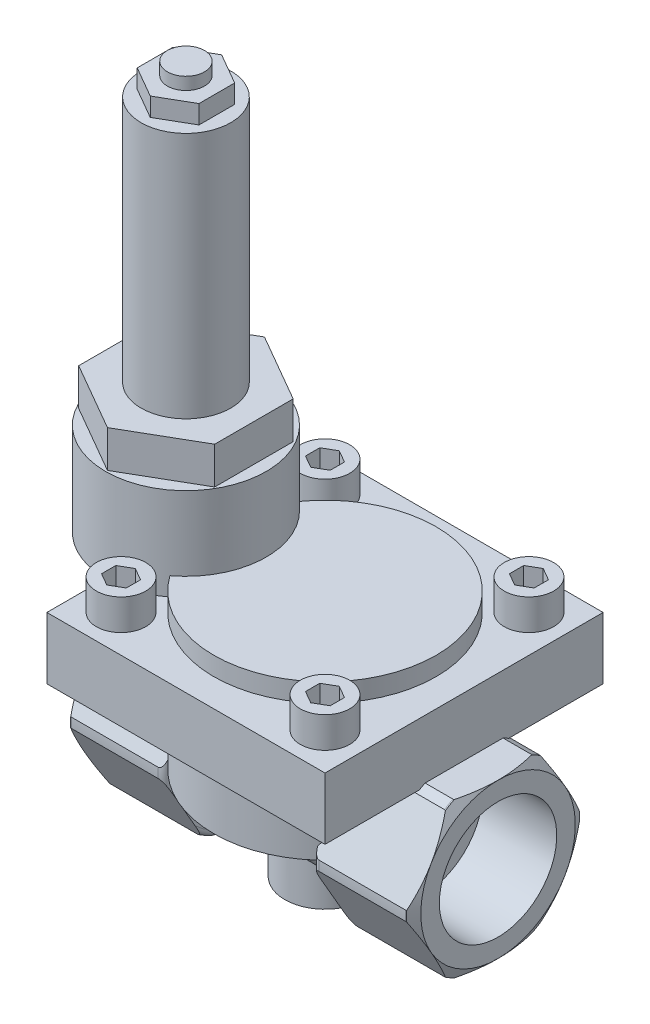
from build123d import *

# Parameters (mm, degrees)
SKIZZE2_OUTSIDE_W               = 43.718
SKIZZE2_OUTSIDE_H               = 43.718
SCHNITT_LINEAR_AUSTRAGEN1_DEPTH = 16
SKIZZE3_OUTSIDE_W               = 216.672
SKIZZE3_OUTSIDE_H               = 213.672
SKIZZE3_OUTSIDE_R               = 12.5
SCHNITT_LINEAR_AUSTRAGEN2_DEPTH = 48
SCHNITT_LINEAR_AUSTRAGEN2_DRAFT = -61
SPIEGELN2_COPY_1_SKETCH_W       = 216.672
SPIEGELN2_COPY_1_SKETCH_H       = 213.672
SPIEGELN2_COPY_1_SKETCH_R       = 12.5
SPIEGELN2_COPY_1_DEPTH          = 48
SPIEGELN2_COPY_1_DRAFT          = -61
SKIZZE4_R                       = 18
AUFSATZ_LINEAR_AUSTRAGEN1_DEPTH = 25
SKIZZE5_R                       = 6.5
AUFSATZ_LINEAR_AUSTRAGEN2_DEPTH = 15
SKIZZE6_W                       = 45
SKIZZE6_H                       = 45
AUFSATZ_LINEAR_AUSTRAGEN3_DEPTH = 10
SKIZZE7_R                       = 4
AUFSATZ_LINEAR_AUSTRAGEN4_DEPTH = 5
SCHNITT_LINEAR_AUSTRAGEN3_DEPTH = 3
SKIZZE9_R                       = 13
AUFSATZ_LINEAR_AUSTRAGEN5_DEPTH = 15
AUFSATZ_LINEAR_AUSTRAGEN6_DEPTH = 6
SKIZZE11_R                      = 7.25
AUFSATZ_LINEAR_AUSTRAGEN7_DEPTH = 40
SKIZZE12_R                      = 3
AUFSATZ_LINEAR_AUSTRAGEN8_DEPTH = 5
AUFSATZ_LINEAR_AUSTRAGEN9_DEPTH = 3


with BuildPart() as part:
    # Skizze1 → Basis-Rotation (revolve)
    with BuildSketch(Plane.XY, mode=Mode.PRIVATE) as basis_rotation_sk:
        with BuildLine():
            Line((-11, 10), (11, 10))
            ThreePointArc((11, 10), (11.707106781, 10.292893219), (12, 11))
            Line((12, 11), (12, 13))
            ThreePointArc((12, 13), (12.292893219, 13.707106781), (13, 14))
            Line((13, 14), (27, 14))
            ThreePointArc((27, 14), (27.707106781, 13.707106781), (28, 13))
            Line((28, 13), (28, 9.5))
            Line((28, 9.5), (16, 9.5))
            Line((16, 9.5), (16, 7))
            Line((16, 7), (-16, 7))
            Line((-16, 7), (-16, 9.5))
            Line((-16, 9.5), (-28, 9.5))
            Line((-28, 9.5), (-28, 13))
            ThreePointArc((-28, 13), (-27.707106781, 13.707106781), (-27, 14))
            Line((-27, 14), (-13, 14))
            ThreePointArc((-13, 14), (-12.292893219, 13.707106781), (-12, 13))
            Line((-12, 13), (-12, 11))
            ThreePointArc((-12, 11), (-11.707106781, 10.292893219), (-11, 10))
        make_face()
    revolve(basis_rotation_sk.sketch.rotate(Axis((-52.931557789, 0, 0), (1, 0, 0)), 90), axis=Axis((-52.931557789, 0, 0), (1, 0, 0)))

    # Skizze2 outside → Schnitt-Linear austragen1 (cut)
    with BuildSketch(Plane.ZY.offset(28)):
        Rectangle(SKIZZE2_OUTSIDE_W, SKIZZE2_OUTSIDE_H)
        Polygon((14.43375673, 0), (7.216878365, 12.5), (-7.216878365, 12.5), (-14.43375673, 0), (-7.216878365, -12.5), (7.216878365, -12.5), align=None, mode=Mode.SUBTRACT)
    schnitt_linear_austragen1 = extrude(amount=-SCHNITT_LINEAR_AUSTRAGEN1_DEPTH, mode=Mode.SUBTRACT)

    # Spiegeln1: Schnitt-Linear austragen1 across plane
    add(schnitt_linear_austragen1.mirror(Plane(origin=(0, 0, 0), x_dir=(0, 0, 1), z_dir=(1, 0, 0))), mode=Mode.SUBTRACT)


with BuildPart() as schnitt_linear_austragen2_tool:
    # Skizze3 outside → Schnitt-Linear austragen2 (with draft: the straight prism first)
    with BuildSketch(Plane.ZY.offset(28)):
        Rectangle(SKIZZE3_OUTSIDE_W, SKIZZE3_OUTSIDE_H)
        Circle(SKIZZE3_OUTSIDE_R, mode=Mode.SUBTRACT)
    extrude(amount=-SCHNITT_LINEAR_AUSTRAGEN2_DEPTH)
    # Schnitt-Linear austragen2: the draft: its side faces are tilted about the plane it starts from
    schnitt_linear_austragen2_sides = [schnitt_linear_austragen2_tool.faces().sort_by_distance(p)[0] for p in [
        (-4, -106.836, 0),
        (-4, 0, 108.336),
        (-4, 106.836, 0),
        (-4, 0, -108.336),
        (-4, 0, -12.5),
    ]]
    draft(schnitt_linear_austragen2_sides, Plane.ZY.offset(28), SCHNITT_LINEAR_AUSTRAGEN2_DRAFT)


with BuildPart() as part_1:
    add(part.part)

    # Schnitt-Linear austragen2: cut by schnitt_linear_austragen2_tool
    add(schnitt_linear_austragen2_tool.part, mode=Mode.SUBTRACT)


with BuildPart() as spiegeln2_copy_1_tool:
    # Spiegeln2 copy 1 sketch → Spiegeln2 copy 1 (with draft: the straight prism first)
    with BuildSketch(Plane(origin=(28, 0, 0), x_dir=(0, 0, 1), z_dir=(1, 0, 0))):
        Rectangle(SPIEGELN2_COPY_1_SKETCH_W, SPIEGELN2_COPY_1_SKETCH_H)
        Circle(SPIEGELN2_COPY_1_SKETCH_R, mode=Mode.SUBTRACT)
    extrude(amount=-SPIEGELN2_COPY_1_DEPTH)
    # Spiegeln2 copy 1: the draft: its side faces are tilted about the plane it starts from
    spiegeln2_copy_1_sides = [spiegeln2_copy_1_tool.faces().sort_by_distance(p)[0] for p in [
        (4, -106.836, 0),
        (4, 0, 108.336),
        (4, 106.836, 0),
        (4, 0, -108.336),
        (4, 0, -12.5),
    ]]
    draft(spiegeln2_copy_1_sides, Plane(origin=(28, 0, 0), x_dir=(0, 0, 1), z_dir=(1, 0, 0)), SPIEGELN2_COPY_1_DRAFT)


with BuildPart() as part_2:
    add(part_1.part)

    # Spiegeln2 copy 1: cut by spiegeln2_copy_1_tool
    add(spiegeln2_copy_1_tool.part, mode=Mode.SUBTRACT)

    # Skizze4 → Aufsatz-Linear austragen1 (add)
    with BuildSketch(Plane(origin=(0, 0, 0), x_dir=(1, 0, 0), z_dir=(0, 1, 0))):
        with Locations(Location((0, 0, 0), (0, 0, 132.092564163))):
            Circle(SKIZZE4_R)
    extrude(amount=AUFSATZ_LINEAR_AUSTRAGEN1_DEPTH)

    # Skizze5 → Aufsatz-Linear austragen2 (add)
    with BuildSketch(Plane(origin=(0, 0, 0), x_dir=(1, 0, 0), z_dir=(0, 1, 0))):
        with Locations(Location((0, 0, 0), (0, 0, 270))):
            Circle(SKIZZE5_R)
    extrude(amount=-AUFSATZ_LINEAR_AUSTRAGEN2_DEPTH)

    # Skizze6 → Aufsatz-Linear austragen3 (add)
    with BuildSketch(Plane(origin=(0, 12, 0), x_dir=(-1, 0, 0), z_dir=(0, 1, 0))):
        Rectangle(SKIZZE6_W, SKIZZE6_H)
    extrude(amount=AUFSATZ_LINEAR_AUSTRAGEN3_DEPTH)

    # Skizze7 → Aufsatz-Linear austragen4 (add)
    with BuildSketch(Plane(origin=(0, 22, 0), x_dir=(-1, 0, 0), z_dir=(0, 1, 0))):
        with Locations(Location((-16.5, 16.5, 0), (0, 0, 90))):
            Circle(SKIZZE7_R)
        with Locations(Location((16.5, 16.5, 0), (0, 0, 270))):
            Circle(SKIZZE7_R)
        with Locations(Location((16.5, -16.5, 0), (0, 0, 90))):
            Circle(SKIZZE7_R)
        with Locations(Location((-16.5, -16.5, 0), (0, 0, 270))):
            Circle(SKIZZE7_R)
    extrude(amount=AUFSATZ_LINEAR_AUSTRAGEN4_DEPTH)

    # Skizze8 → Schnitt-Linear austragen3 (cut)
    with BuildSketch(Plane(origin=(0, 27, 0), x_dir=(-1, 0, 0), z_dir=(0, 1, 0))):
        Polygon((-16.5, 14.190598923), (-14.5, 15.345299462), (-14.5, 17.654700538), (-16.5, 18.809401077), (-18.5, 17.654700538), (-18.5, 15.345299462), align=None)
        Polygon((14.5, 17.654700538), (16.5, 18.809401077), (18.5, 17.654700538), (18.5, 15.345299462), (16.5, 14.190598923), (14.5, 15.345299462), align=None)
        Polygon((16.5, -14.190598923), (14.5, -15.345299462), (14.5, -17.654700538), (16.5, -18.809401077), (18.5, -17.654700538), (18.5, -15.345299462), align=None)
        Polygon((-18.5, -15.345299462), (-16.5, -14.190598923), (-14.5, -15.345299462), (-14.5, -17.654700538), (-16.5, -18.809401077), (-18.5, -17.654700538), align=None)
    extrude(amount=-SCHNITT_LINEAR_AUSTRAGEN3_DEPTH, mode=Mode.SUBTRACT)

    # Skizze9 → Aufsatz-Linear austragen5 (add)
    with BuildSketch(Plane(origin=(0, 22, 0), x_dir=(-1, 0, 0), z_dir=(0, 1, 0))):
        with Locations(Location((22.5, 0, 0), (0, 0, 90))):
            Circle(SKIZZE9_R)
    extrude(amount=AUFSATZ_LINEAR_AUSTRAGEN5_DEPTH)

    # Skizze10 → Aufsatz-Linear austragen6 (add)
    with BuildSketch(Plane(origin=(0, 37, 0), x_dir=(-1, 0, 0), z_dir=(0, 1, 0))):
        Polygon((22.5, -12.701705922), (33.5, -6.350852961), (33.5, 6.350852961), (22.5, 12.701705922), (11.5, 6.350852961), (11.5, -6.350852961), align=None)
    extrude(amount=AUFSATZ_LINEAR_AUSTRAGEN6_DEPTH)

    # Skizze11 → Aufsatz-Linear austragen7 (add)
    with BuildSketch(Plane(origin=(0, 43, 0), x_dir=(1, 0, 0), z_dir=(0, 1, 0))):
        with Locations(Location((-22.5, 0, 0), (0, 0, 270))):
            Circle(SKIZZE11_R)
    extrude(amount=AUFSATZ_LINEAR_AUSTRAGEN7_DEPTH)

    # Skizze12 → Aufsatz-Linear austragen8 (add)
    with BuildSketch(Plane(origin=(0, 83, 0), x_dir=(1, 0, 0), z_dir=(0, 1, 0))):
        with Locations(Location((-22.5, 0, 0), (0, 0, 270))):
            Circle(SKIZZE12_R)
    extrude(amount=AUFSATZ_LINEAR_AUSTRAGEN8_DEPTH)

    # Skizze13 → Aufsatz-Linear austragen9 (add)
    with BuildSketch(Plane(origin=(0, 83, 0), x_dir=(1, 0, 0), z_dir=(0, 1, 0))):
        Polygon((-17.5, -2.886751346), (-17.5, 2.886751346), (-22.5, 5.773502692), (-27.5, 2.886751346), (-27.5, -2.886751346), (-22.5, -5.773502692), align=None)
    extrude(amount=AUFSATZ_LINEAR_AUSTRAGEN9_DEPTH)


solid = part_2.part
